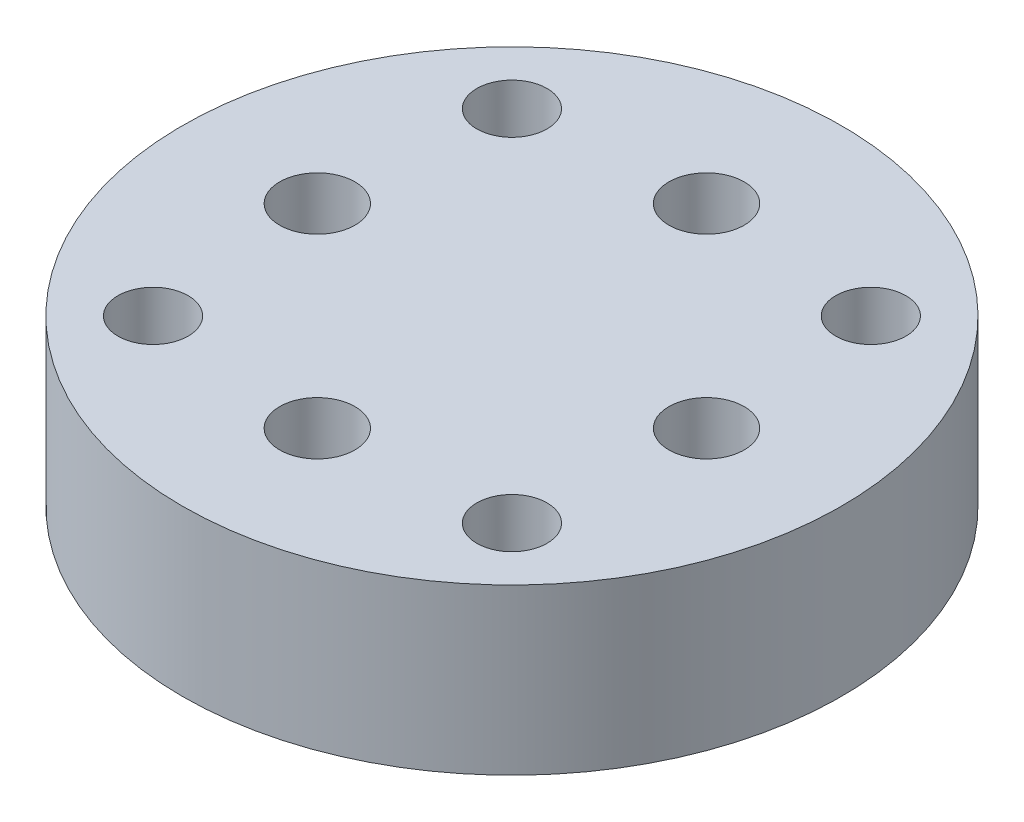
from build123d import *

# Parameters (mm, degrees)
SKETCH2_R                                         = 12.7
BOSS_EXTRUDE1_DEPTH                               = 6.35
CSK_FOR_M2_5_FLAT_HEAD_MACHINE_SCREW1_D           = 2.9
CSK_FOR_M2_5_FLAT_HEAD_MACHINE_SCREW1_CSINK_D     = 5.5
CSK_FOR_M2_5_FLAT_HEAD_MACHINE_SCREW1_CSINK_ANGLE = 90
F_6_32_TAPPED_HOLE1_D                             = 2.7051
F_6_32_TAPPED_HOLE1_DEPTH                         = 9.38784
F_6_32_TAPPED_HOLE1_TIP                           = 0.81269403


with BuildPart() as part:
    # Sketch2 → Boss-Extrude1 (new body)
    with BuildSketch(Plane(origin=(0, 0, 0), x_dir=(1, 0, 0), z_dir=(0, 1, 0))):
        with Locations(Location((0, 0, 0), (0, 0, 270))):
            Circle(SKETCH2_R)
    extrude(amount=BOSS_EXTRUDE1_DEPTH)

    # CSK for M2.5 Flat Head Machine Screw1 (through all)
    with Locations(Plane(origin=(0, 0, 0), x_dir=(-1, 0, 0), z_dir=(0, -1, 0))):
        with Locations((7.5, 0), (-7.5, 0), (0, -7.5), (0, 7.5)):
            CounterSinkHole(CSK_FOR_M2_5_FLAT_HEAD_MACHINE_SCREW1_D / 2, CSK_FOR_M2_5_FLAT_HEAD_MACHINE_SCREW1_CSINK_D / 2, counter_sink_angle=CSK_FOR_M2_5_FLAT_HEAD_MACHINE_SCREW1_CSINK_ANGLE)

    # #6-32 Tapped Hole1
    with Locations(Plane(origin=(0, 0, 0), x_dir=(-1, 0, 0), z_dir=(0, -1, 0))):
        with Locations((6.914797213, -6.914797213), (-6.914797213, -6.914797213), (-6.914797213, 6.914797213), (6.914797213, 6.914797213)):
            Hole(F_6_32_TAPPED_HOLE1_D / 2, depth=F_6_32_TAPPED_HOLE1_DEPTH)
            with Locations((0, 0, -(F_6_32_TAPPED_HOLE1_DEPTH + F_6_32_TAPPED_HOLE1_TIP / 2))):  # 118° drill point
                Cone(0, F_6_32_TAPPED_HOLE1_D / 2, F_6_32_TAPPED_HOLE1_TIP, mode=Mode.SUBTRACT)


solid = part.part
